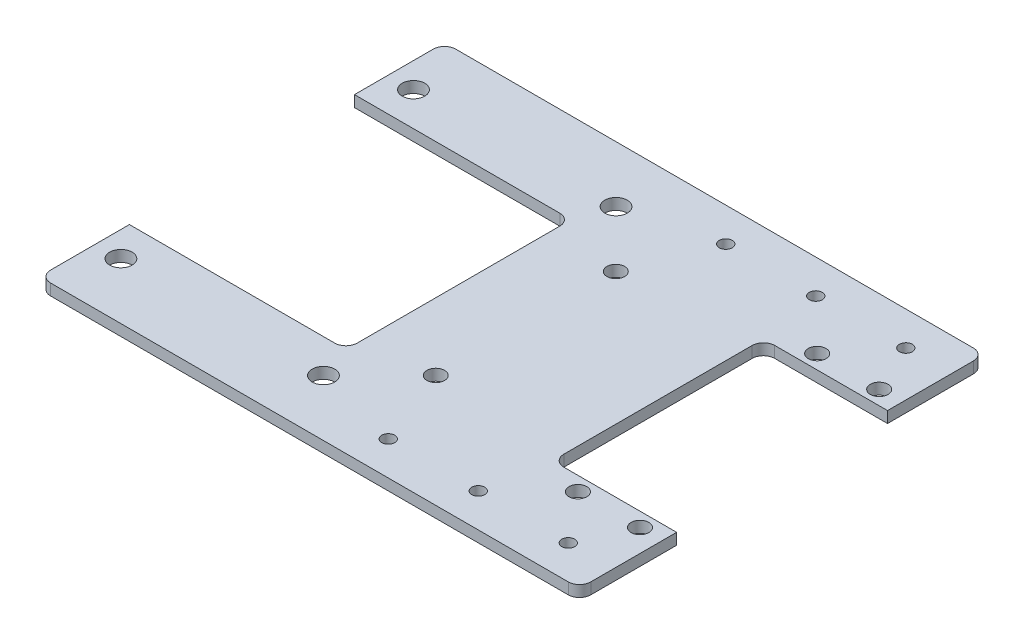
from build123d import *

# Parameters (mm, degrees)
SKETCH1_W           = 152.4
SKETCH1_H           = 114.3
SKETCH1_R           = 3.175
SKETCH1_R_2         = 2.5
BOSS_EXTRUDE1_DEPTH = 3.175
CUT_EXTRUDE1_REACH  = 158.144
SKETCH2_W           = 35
SKETCH2_H           = 59.5
FILLET1_R           = 3.175
SKETCH4_R           = 2.4892
CUT_EXTRUDE2_DEPTH  = 157.144256218
SKETCH5_R           = 1.8288
CUT_EXTRUDE3_DEPTH  = 157.144256218


with BuildPart() as part:
    # Sketch1 → Boss-Extrude1 (new body)
    with BuildSketch(Plane(origin=(0, 0, 0), x_dir=(1, 0, 0), z_dir=(0, 1, 0))):
        with Locations((69.075, 0)):
            Rectangle(SKETCH1_W, SKETCH1_H)
        with Locations(Location((0, 41.275, 0), (0, 0, 270))):
            Circle(SKETCH1_R, mode=Mode.SUBTRACT)
        with Locations(Location((121.425, 33.75, 0), (0, 0, 270))):
            Circle(SKETCH1_R_2, mode=Mode.SUBTRACT)
        with Locations(Location((138.925, 33.75, 0), (0, 0, 270))):
            Circle(SKETCH1_R_2, mode=Mode.SUBTRACT)
        with Locations(Location((138.925, -33.75, 0), (0, 0, 90))):
            Circle(SKETCH1_R_2, mode=Mode.SUBTRACT)
        with Locations(Location((121.425, -33.75, 0), (0, 0, 90))):
            Circle(SKETCH1_R_2, mode=Mode.SUBTRACT)
        with Locations(Location((0, -41.275, 0), (0, 0, 90))):
            Circle(SKETCH1_R, mode=Mode.SUBTRACT)
        with Locations(Location((57.15, 41.275, 0), (0, 0, 270))):
            Circle(SKETCH1_R, mode=Mode.SUBTRACT)
        with Locations(Location((57.15, -41.275, 0), (0, 0, 90))):
            Circle(SKETCH1_R, mode=Mode.SUBTRACT)
    extrude(amount=BOSS_EXTRUDE1_DEPTH)

    # Sketch2 → Cut-Extrude1 (cut, up to next)
    with BuildSketch(Plane(origin=(0, 3.175, 0), x_dir=(1, 0, 0), z_dir=(0, 1, 0)), mode=Mode.PRIVATE) as cut_extrude1_sk1:
        with Locations((127.775, 0)):
            Rectangle(SKETCH2_W, SKETCH2_H)
    cut_extrude1_tool1 = extrude(cut_extrude1_sk1.sketch, amount=-CUT_EXTRUDE1_REACH, mode=Mode.PRIVATE) & part.part
    # Sketch2 → Cut-Extrude1 (cut, up to next)
    with BuildSketch(Plane(origin=(0, 3.175, 0), x_dir=(1, 0, 0), z_dir=(0, 1, 0)), mode=Mode.PRIVATE) as cut_extrude1_sk2:
        Polygon((-7.125, 0), (-7.125, -31.75), (53.975, -31.75), (53.975, 0), (53.975, 31.75), (-7.125, 31.75), align=None)
    cut_extrude1_tool2 = extrude(cut_extrude1_sk2.sketch, amount=-CUT_EXTRUDE1_REACH, mode=Mode.PRIVATE) & part.part
    add(cut_extrude1_tool1.solids().sort_by_distance((127.775, 3.175, 0))[0], mode=Mode.SUBTRACT)
    add(cut_extrude1_tool2.solids().sort_by_distance((23.425, 3.175, 0))[0], mode=Mode.SUBTRACT)

    # Fillet1
    fillet1_edges = [part.edges().sort_by_distance(p)[0] for p in [
        (110.275, 1.5875, 29.75),
        (110.275, 1.5875, -29.75),
        (53.975, 1.5875, 31.75),
        (53.975, 1.5875, -31.75),
        (145.275, 1.5875, -57.15),
        (145.275, 1.5875, 57.15),
        (-7.125, 1.5875, 57.15),
        (-7.125, 1.5875, -57.15),
    ]]
    fillet(fillet1_edges, radius=FILLET1_R)

    # Sketch4 → Cut-Extrude2 (cut, through all)
    with BuildSketch(Plane(origin=(0, 3.175, 0), x_dir=(1, 0, 0), z_dir=(0, 1, 0))):
        with Locations(Location((72.962713681, 25.4, 0), (0, 0, 270))):
            Circle(SKETCH4_R)
        with Locations(Location((72.962713681, -25.4, 0), (0, 0, 270))):
            Circle(SKETCH4_R)
    extrude(amount=-CUT_EXTRUDE2_DEPTH, mode=Mode.SUBTRACT)

    # Sketch5 → Cut-Extrude3 (cut, through all)
    with BuildSketch(Plane(origin=(0, 3.175, 0), x_dir=(1, 0, 0), z_dir=(0, 1, 0))):
        with Locations(Location((132.575, -47.61738, 0), (0, 0, 270))):
            Circle(SKETCH5_R)
        with Locations(Location((81.775, -47.61738, 0), (0, 0, 270))):
            Circle(SKETCH5_R)
        with Locations(Location((107.175, -47.61738, 0), (0, 0, 270))):
            Circle(SKETCH5_R)
        with Locations(Location((107.175, 47.61738, 0), (0, 0, 90))):
            Circle(SKETCH5_R)
        with Locations(Location((81.775, 47.61738, 0), (0, 0, 90))):
            Circle(SKETCH5_R)
        with Locations(Location((132.575, 47.61738, 0), (0, 0, 90))):
            Circle(SKETCH5_R)
    extrude(amount=-CUT_EXTRUDE3_DEPTH, mode=Mode.SUBTRACT)


solid = part.part
